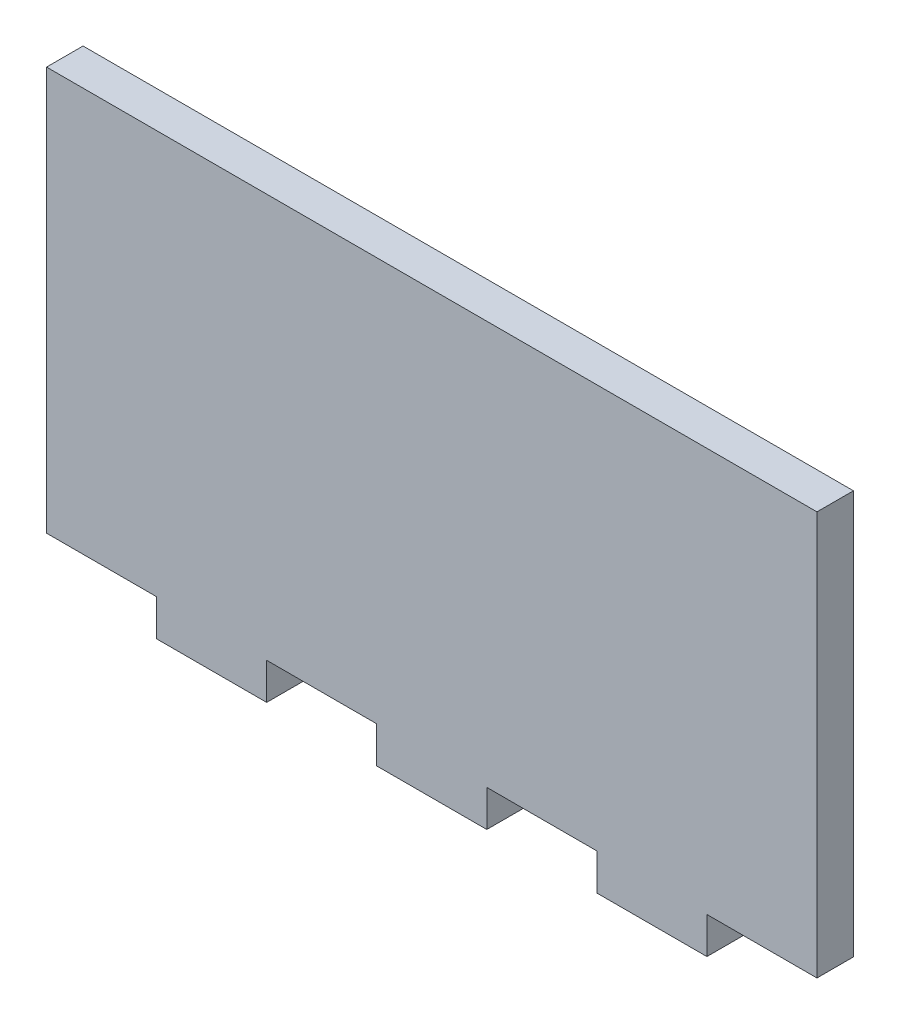
from build123d import *

# Parameters (mm, degrees)
SKETCH3_W           = 67.056
SKETCH3_H           = 35.13836
BOSS_EXTRUDE1_DEPTH = 3.175
SKETCH4_W           = 9.579428572
SKETCH4_H           = 3.175
BOSS_EXTRUDE3_DEPTH = 3.175
LPATTERN1_COUNT     = 3
LPATTERN1_PITCH     = 19.158857143


with BuildPart() as part:
    # Sketch3 → Boss-Extrude1 (new body)
    with BuildSketch(Plane.XY):
        with Locations((-33.528, 17.56918)):
            Rectangle(SKETCH3_W, SKETCH3_H)
    extrude(amount=BOSS_EXTRUDE1_DEPTH)

    # Sketch4 → Boss-Extrude3 (add)
    with BuildSketch(Plane.XY.offset(3.175)):
        with Locations((-52.686857143, -1.5875)):
            Rectangle(SKETCH4_W, SKETCH4_H)
    boss_extrude3 = extrude(amount=-BOSS_EXTRUDE3_DEPTH)

    # LPattern1: Boss-Extrude3 ×3
    with Locations(*[(i * LPATTERN1_PITCH, 0, 0) for i in range(1, LPATTERN1_COUNT)]):
        add(boss_extrude3)


solid = part.part
